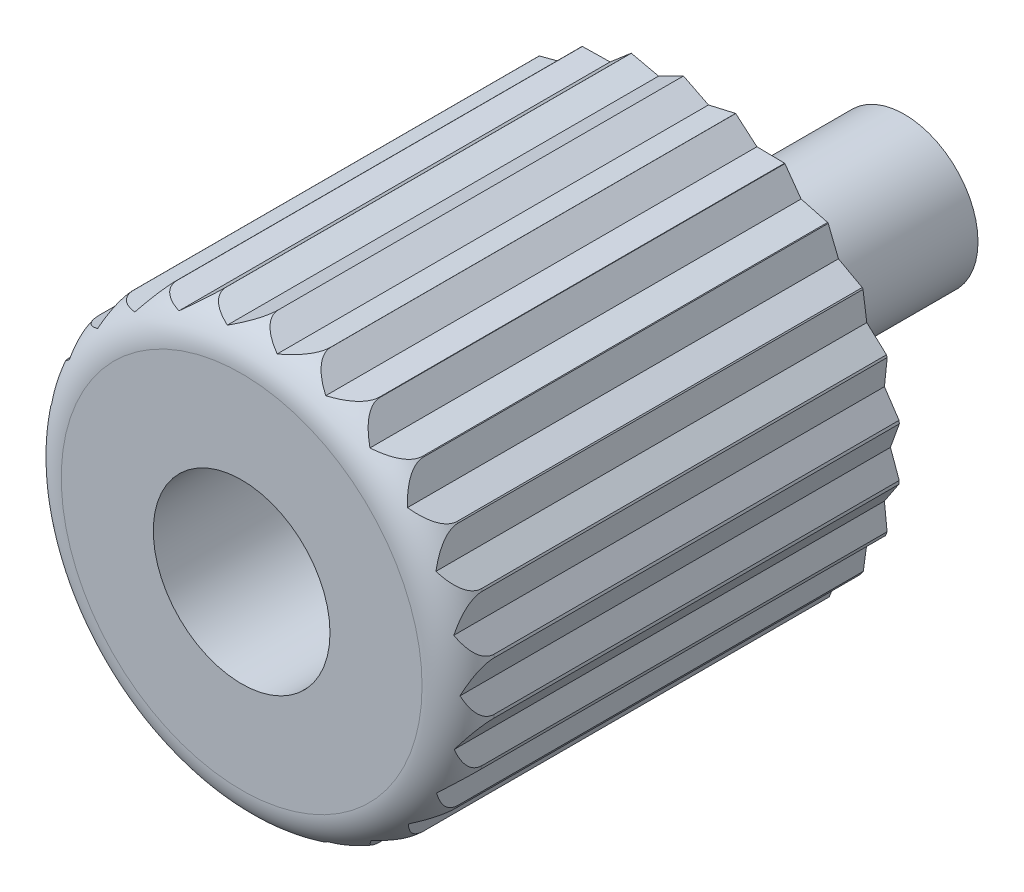
from build123d import *

# Parameters (mm, degrees)
CROQUIS1_R              = 1
SALIENTE_EXTRUIR1_DEPTH = 3
CROQUIS2_R              = 2.95
SALIENTE_EXTRUIR2_DEPTH = 6
REDONDEO2_R             = 0.5
CROQUIS3_R              = 1.2
CORTAR_EXTRUIR2_DEPTH   = 5
CROQUIS4_R              = 3.594982935
CORTAR_EXTRUIR3_DEPTH   = 10.919929465


with BuildPart() as part:
    # Croquis1 → Saliente-Extruir1 (new body)
    with BuildSketch(Plane.XY):
        Circle(CROQUIS1_R)
    extrude(amount=SALIENTE_EXTRUIR1_DEPTH)

    # Croquis2 → Saliente-Extruir2 (add)
    with BuildSketch(Plane.XY.offset(3)):
        Circle(CROQUIS2_R)
    extrude(amount=SALIENTE_EXTRUIR2_DEPTH)

    # Redondeo2
    redondeo2_edges = [part.edges().sort_by_distance(p)[0] for p in [
        (-2.95, 0, 9),
    ]]
    fillet(redondeo2_edges, radius=REDONDEO2_R)

    # Croquis3 → Cortar-Extruir2 (cut)
    with BuildSketch(Plane.XY.offset(9)):
        Circle(CROQUIS3_R)
    extrude(amount=-CORTAR_EXTRUIR2_DEPTH, mode=Mode.SUBTRACT)

    # Croquis4 → Cortar-Extruir3 (cut, through all)
    with BuildSketch(Plane.XY.offset(9)):
        Circle(CROQUIS4_R)
        Polygon((-0.33788255, 2.7795387), (0, 2.95), (0.339785977, 2.779306656), (0.708644333, 2.863954074), (0.997707156, 2.616904662), (1.376104612, 2.610818798), (1.597645, 2.301770931), (1.963590471, 2.205305472), (2.104733303, 1.852219889), (2.436959368, 1.670981058), (2.489501935, 1.29437781), (2.768700823, 1.038898548), (2.729589542, 0.660664447), (2.939535229, 0.34579228), (2.811043105, -0.012091083), (2.93953431, -0.368056928), (2.729128839, -0.684790673), (2.768698121, -1.061162756), (2.488607304, -1.318339469), (2.436955039, -1.693244412), (2.103456736, -1.875917917), (1.963584767, -2.227567607), (1.596060687, -2.325121585), (1.376097864, -2.633079421), (0.995907171, -2.639844388), (0.708636933, -2.88621298), (0.337874929, -2.801795781), (-7.621e-06, -2.972257082), (-0.339793598, -2.801563738), (-0.708651954, -2.886211156), (-0.997714777, -2.639161744), (-1.376112233, -2.633075879), (-1.597652621, -2.324028013), (-1.963598092, -2.227562554), (-2.104740924, -1.874476971), (-2.436966989, -1.693238139), (-2.489509556, -1.316634892), (-2.768708444, -1.06115563), (-2.729597163, -0.682921529), (-2.93954285, -0.368049362), (-2.811050726, -0.010165999), (-2.939541931, 0.345799846), (-2.729136461, 0.662533591), (-2.768705742, 1.038905674), (-2.488614925, 1.296082387), (-2.43696266, 1.67098733), (-2.103464357, 1.853660835), (-1.963592388, 2.205310526), (-1.596068308, 2.302864503), (-1.376105485, 2.610822339), (-0.995914792, 2.617587306), (-0.708644555, 2.863955898), align=None, mode=Mode.SUBTRACT)
    extrude(amount=-CORTAR_EXTRUIR3_DEPTH, mode=Mode.SUBTRACT)


solid = part.part
